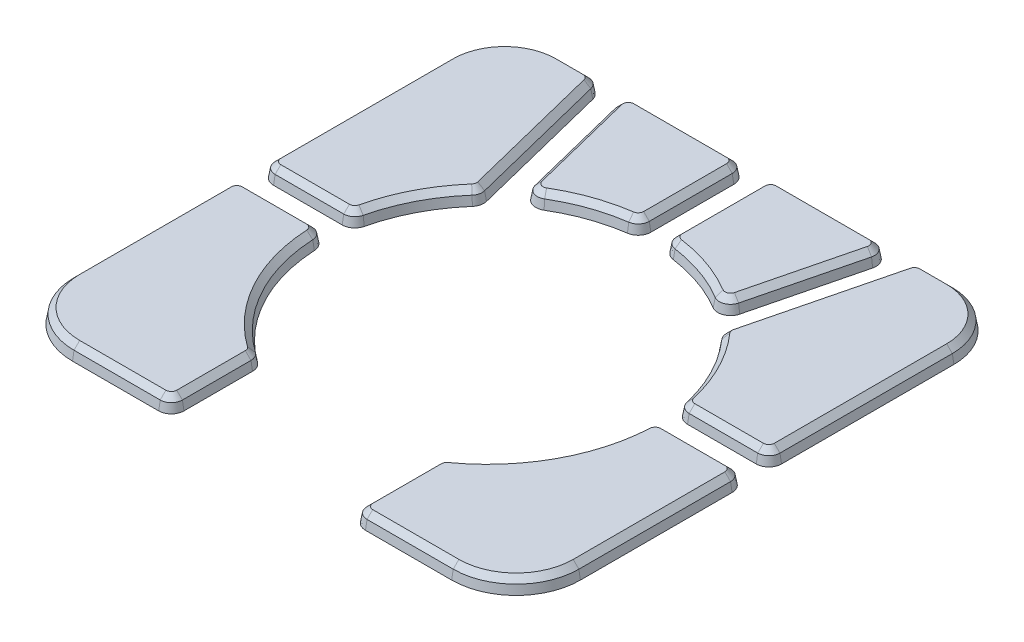
from build123d import *
from OCP.BRepFilletAPI import BRepFilletAPI_MakeChamfer

# Parameters (mm, degrees)
BOSS_EXTRUDE1_DEPTH           = 2.5
BOSS_EXTRUDE1_DRAFT           = 10
BOSS_EXTRUDE1_PROFILE_2_DEPTH = 2.5
BOSS_EXTRUDE1_PROFILE_2_DRAFT = 10
BOSS_EXTRUDE1_PROFILE_3_DEPTH = 2.5
BOSS_EXTRUDE1_PROFILE_3_DRAFT = 10
BOSS_EXTRUDE1_PROFILE_4_DEPTH = 2.5
BOSS_EXTRUDE1_PROFILE_4_DRAFT = 10
BOSS_EXTRUDE1_PROFILE_5_DEPTH = 2.5
BOSS_EXTRUDE1_PROFILE_5_DRAFT = 10
BOSS_EXTRUDE1_PROFILE_6_DEPTH = 2.5
BOSS_EXTRUDE1_PROFILE_6_DRAFT = 10
CHAMFER1_SIZE                 = 1
CHAMFER1_SIZE2                = 0.811159575
CHAMFER2_SIZE                 = 1
CHAMFER2_SIZE2                = 0.811159575
CHAMFER3_SIZE                 = 1
CHAMFER3_SIZE2                = 0.811159575
CHAMFER4_SIZE                 = 1
CHAMFER4_SIZE2                = 0.811159575
CHAMFER5_SIZE                 = 1
CHAMFER5_SIZE2                = 0.811159575
CHAMFER6_SIZE                 = 1
CHAMFER6_SIZE2                = 0.811159575
SKETCH4_R                     = 2.2
CUT_EXTRUDE2_DEPTH            = 2


with BuildPart() as part:
    # Sketch2 → Boss-Extrude1 (with draft: the straight prism first)
    with BuildSketch(Plane(origin=(0, 0, 0), x_dir=(1, 0, 0), z_dir=(0, 1, 0))):
        with BuildLine():
            Line((-4.3, 47.2), (-20.460175103, 47.2))
            ThreePointArc((-20.460175103, 47.2), (-22.193798761, 46.354455246), (-22.594825701, 44.46777183))
            Line((-22.594825701, 44.46777183), (-17.977666103, 25.949356145))
            ThreePointArc((-17.977666103, 25.949356145), (-16.686858715, 24.449853862), (-14.713533712, 24.593656647))
            ThreePointArc((-14.713533712, 24.593656647), (-9.543094512, 27.023422594), (-3.993443984, 28.379366214))
            ThreePointArc((-3.993443984, 28.379366214), (-2.639514644, 29.114716318), (-2.1, 30.557903202))
            Line((-2.1, 30.557903202), (-2.1, 45))
            ThreePointArc((-2.1, 45), (-2.744365081, 46.555634919), (-4.3, 47.2))
        make_face()
    extrude(amount=BOSS_EXTRUDE1_DEPTH)
    # Boss-Extrude1: the draft: its side faces are tilted about the plane it starts from
    boss_extrude1_sides = [part.faces().sort_by_distance(p)[0] for p in [
        (-2.744365081, 1.25, -46.555634919),
        (-12.380087552, 1.25, -47.2),
        (-22.193798761, 1.25, -46.354455246),
        (-20.286245902, 1.25, -35.208563987),
        (-16.686858715, 1.25, -24.449853862),
        (-9.543094512, 1.25, -27.023422594),
        (-2.639514644, 1.25, -29.114716318),
        (-2.1, 1.25, -37.778951601),
    ]]
    draft(boss_extrude1_sides, Plane(origin=(0, 0, 0), x_dir=(1, 0, 0), z_dir=(0, 1, 0)), BOSS_EXTRUDE1_DRAFT)

    # Chamfer3: one chamfer whose edges measure the first distance from different faces: ONE call of the kernel's chamfer builder (chamfer() names one face for all edges)
    chamfer3_edges_1 = [part.edges().sort_by_distance(p)[0] for p in [
        (-21.846429869, 2.5, -46.083060923),
    ]]
    chamfer3_side_1 = [part.faces().sort_by_distance(p)[0] for p in [
        (-22.020114315, 1.25, -46.218758084),
    ]]
    chamfer3_edges_2 = [part.edges().sort_by_distance(p)[0] for p in [
        (-19.858522612, 2.5, -35.315207381),
    ]]
    chamfer3_side_2 = [part.faces().sort_by_distance(p)[0] for p in [
        (-20.072384257, 1.25, -35.261885684),
    ]]
    chamfer3_edges_3 = [part.edges().sort_by_distance(p)[0] for p in [
        (-16.517776527, 2.5, -24.85695488),
    ]]
    chamfer3_side_3 = [part.faces().sort_by_distance(p)[0] for p in [
        (-16.602317621, 1.25, -24.653404371),
    ]]
    chamfer3_edges_4 = [part.edges().sort_by_distance(p)[0] for p in [
        (-9.689881504, 2.5, -27.439083038),
    ]]
    chamfer3_side_4 = [part.faces().sort_by_distance(p)[0] for p in [
        (-9.616488008, 1.25, -27.231252816),
    ]]
    chamfer3_edges_5 = [part.edges().sort_by_distance(p)[0] for p in [
        (-2.9722287, 2.5, -29.403889939),
    ]]
    chamfer3_side_5 = [part.faces().sort_by_distance(p)[0] for p in [
        (-2.805871672, 1.25, -29.259303128),
    ]]
    chamfer3_edges_6 = [part.edges().sort_by_distance(p)[0] for p in [
        (-2.540817452, 2.5, -37.778951601),
    ]]
    chamfer3_side_6 = [part.faces().sort_by_distance(p)[0] for p in [
        (-2.320408726, 1.25, -37.778951601),
    ]]
    chamfer3_edges_7 = [part.edges().sort_by_distance(p)[0] for p in [
        (-3.056070091, 2.5, -46.243929909),
    ]]
    chamfer3_side_7 = [part.faces().sort_by_distance(p)[0] for p in [
        (-2.900217586, 1.25, -46.399782414),
    ]]
    chamfer3_edges_8 = [part.edges().sort_by_distance(p)[0] for p in [
        (-12.380087552, 2.5, -46.759182548),
    ]]
    chamfer3_side_8 = [part.faces().sort_by_distance(p)[0] for p in [
        (-12.380087552, 1.25, -46.979591274),
    ]]
    chamfer3 = BRepFilletAPI_MakeChamfer(part.part.solid().wrapped)
    for e in chamfer3_edges_1:
        chamfer3.Add(CHAMFER3_SIZE, CHAMFER3_SIZE2, e.wrapped, chamfer3_side_1[0].wrapped)  # the first distance lies on this face
    for e in chamfer3_edges_2:
        chamfer3.Add(CHAMFER3_SIZE, CHAMFER3_SIZE2, e.wrapped, chamfer3_side_2[0].wrapped)  # the first distance lies on this face
    for e in chamfer3_edges_3:
        chamfer3.Add(CHAMFER3_SIZE, CHAMFER3_SIZE2, e.wrapped, chamfer3_side_3[0].wrapped)  # the first distance lies on this face
    for e in chamfer3_edges_4:
        chamfer3.Add(CHAMFER3_SIZE, CHAMFER3_SIZE2, e.wrapped, chamfer3_side_4[0].wrapped)  # the first distance lies on this face
    for e in chamfer3_edges_5:
        chamfer3.Add(CHAMFER3_SIZE, CHAMFER3_SIZE2, e.wrapped, chamfer3_side_5[0].wrapped)  # the first distance lies on this face
    for e in chamfer3_edges_6:
        chamfer3.Add(CHAMFER3_SIZE, CHAMFER3_SIZE2, e.wrapped, chamfer3_side_6[0].wrapped)  # the first distance lies on this face
    for e in chamfer3_edges_7:
        chamfer3.Add(CHAMFER3_SIZE, CHAMFER3_SIZE2, e.wrapped, chamfer3_side_7[0].wrapped)  # the first distance lies on this face
    for e in chamfer3_edges_8:
        chamfer3.Add(CHAMFER3_SIZE, CHAMFER3_SIZE2, e.wrapped, chamfer3_side_8[0].wrapped)  # the first distance lies on this face
    add(Compound.cast(chamfer3.Shape()), mode=Mode.REPLACE)


with BuildPart() as body_2:
    # Sketch2 → Boss-Extrude1 profile 2 (with draft: the straight prism first)
    with BuildSketch(Plane(origin=(0, 0, 0), x_dir=(1, 0, 0), z_dir=(0, 1, 0))):
        with BuildLine():
            Line((-42, 4.8), (-30.054541223, 4.8))
            ThreePointArc((-30.054541223, 4.8), (-28.686677613, 5.276936117), (-27.911889966, 6.500955324))
            ThreePointArc((-27.911889966, 6.500955324), (-25.488118202, 13.103123753), (-21.52937617, 18.916183106))
            ThreePointArc((-21.52937617, 18.916183106), (-21.044227674, 19.849041411), (-21.047424296, 20.9005087))
            Line((-21.047424296, 20.9005087), (-27.188801718, 45.53222817))
            ThreePointArc((-27.188801718, 45.53222817), (-27.96899707, 46.733623658), (-29.323452316, 47.2))
            Line((-29.323452316, 47.2), (-34, 47.2))
            ThreePointArc((-34, 47.2), (-41.212489168, 44.212489168), (-44.2, 37))
            Line((-44.2, 37), (-44.2, 7))
            ThreePointArc((-44.2, 7), (-43.555634919, 5.444365081), (-42, 4.8))
        make_face()
    extrude(amount=BOSS_EXTRUDE1_PROFILE_2_DEPTH)
    # Boss-Extrude1 profile 2: the draft: its side faces are tilted about the plane it starts from
    boss_extrude1_profile_2_sides = [body_2.faces().sort_by_distance(p)[0] for p in [
        (-36.027270612, 1.25, -4.8),
        (-28.686677613, 1.25, -5.276936117),
        (-25.488118202, 1.25, -13.103123753),
        (-21.044227674, 1.25, -19.849041411),
        (-24.118113007, 1.25, -33.216368435),
        (-27.96899707, 1.25, -46.733623658),
        (-31.661726158, 1.25, -47.2),
        (-41.212489168, 1.25, -44.212489168),
        (-44.2, 1.25, -22),
        (-43.555634919, 1.25, -5.444365081),
    ]]
    draft(boss_extrude1_profile_2_sides, Plane(origin=(0, 0, 0), x_dir=(1, 0, 0), z_dir=(0, 1, 0)), BOSS_EXTRUDE1_PROFILE_2_DRAFT)

    # Chamfer2: one chamfer whose edges measure the first distance from different faces: ONE call of the kernel's chamfer builder (chamfer() names one face for all edges)
    chamfer2_edges_1 = [body_2.edges().sort_by_distance(p)[0] for p in [
        (-28.240391393, 2.5, -46.386254766),
    ]]
    chamfer2_side_1 = [body_2.faces().sort_by_distance(p)[0] for p in [
        (-28.104694231, 1.25, -46.559939212),
    ]]
    chamfer2_edges_2 = [body_2.edges().sort_by_distance(p)[0] for p in [
        (-31.661726158, 2.5, -46.759182548),
    ]]
    chamfer2_side_2 = [body_2.faces().sort_by_distance(p)[0] for p in [
        (-31.661726158, 1.25, -46.979591274),
    ]]
    chamfer2_edges_3 = [body_2.edges().sort_by_distance(p)[0] for p in [
        (-40.900784159, 2.5, -43.900784159),
    ]]
    chamfer2_side_3 = [body_2.faces().sort_by_distance(p)[0] for p in [
        (-41.056636663, 1.25, -44.056636663),
    ]]
    chamfer2_edges_4 = [body_2.edges().sort_by_distance(p)[0] for p in [
        (-43.759182548, 2.5, -22),
    ]]
    chamfer2_side_4 = [body_2.faces().sort_by_distance(p)[0] for p in [
        (-43.979591274, 1.25, -22),
    ]]
    chamfer2_edges_5 = [body_2.edges().sort_by_distance(p)[0] for p in [
        (-43.243929909, 2.5, -5.756070091),
    ]]
    chamfer2_side_5 = [body_2.faces().sort_by_distance(p)[0] for p in [
        (-43.399782414, 1.25, -5.600217586),
    ]]
    chamfer2_edges_6 = [body_2.edges().sort_by_distance(p)[0] for p in [
        (-36.027270612, 2.5, -5.240817452),
    ]]
    chamfer2_side_6 = [body_2.faces().sort_by_distance(p)[0] for p in [
        (-36.027270612, 1.25, -5.020408726),
    ]]
    chamfer2_edges_7 = [body_2.edges().sort_by_distance(p)[0] for p in [
        (-28.960758591, 2.5, -5.622189131),
    ]]
    chamfer2_side_7 = [body_2.faces().sort_by_distance(p)[0] for p in [
        (-28.823718102, 1.25, -5.449562624),
    ]]
    chamfer2_edges_8 = [body_2.edges().sort_by_distance(p)[0] for p in [
        (-25.880163381, 2.5, -13.30466929),
    ]]
    chamfer2_side_8 = [body_2.faces().sort_by_distance(p)[0] for p in [
        (-25.684140792, 1.25, -13.203896521),
    ]]
    chamfer2_edges_9 = [body_2.edges().sort_by_distance(p)[0] for p in [
        (-21.472591475, 2.5, -19.953082168),
    ]]
    chamfer2_side_9 = [body_2.faces().sort_by_distance(p)[0] for p in [
        (-21.258409575, 1.25, -19.901061789),
    ]]
    chamfer2_edges_10 = [body_2.edges().sort_by_distance(p)[0] for p in [
        (-24.545836297, 2.5, -33.109725042),
    ]]
    chamfer2_side_10 = [body_2.faces().sort_by_distance(p)[0] for p in [
        (-24.331974652, 1.25, -33.163046739),
    ]]
    chamfer2 = BRepFilletAPI_MakeChamfer(body_2.part.solid().wrapped)
    for e in chamfer2_edges_1:
        chamfer2.Add(CHAMFER2_SIZE, CHAMFER2_SIZE2, e.wrapped, chamfer2_side_1[0].wrapped)  # the first distance lies on this face
    for e in chamfer2_edges_2:
        chamfer2.Add(CHAMFER2_SIZE, CHAMFER2_SIZE2, e.wrapped, chamfer2_side_2[0].wrapped)  # the first distance lies on this face
    for e in chamfer2_edges_3:
        chamfer2.Add(CHAMFER2_SIZE, CHAMFER2_SIZE2, e.wrapped, chamfer2_side_3[0].wrapped)  # the first distance lies on this face
    for e in chamfer2_edges_4:
        chamfer2.Add(CHAMFER2_SIZE, CHAMFER2_SIZE2, e.wrapped, chamfer2_side_4[0].wrapped)  # the first distance lies on this face
    for e in chamfer2_edges_5:
        chamfer2.Add(CHAMFER2_SIZE, CHAMFER2_SIZE2, e.wrapped, chamfer2_side_5[0].wrapped)  # the first distance lies on this face
    for e in chamfer2_edges_6:
        chamfer2.Add(CHAMFER2_SIZE, CHAMFER2_SIZE2, e.wrapped, chamfer2_side_6[0].wrapped)  # the first distance lies on this face
    for e in chamfer2_edges_7:
        chamfer2.Add(CHAMFER2_SIZE, CHAMFER2_SIZE2, e.wrapped, chamfer2_side_7[0].wrapped)  # the first distance lies on this face
    for e in chamfer2_edges_8:
        chamfer2.Add(CHAMFER2_SIZE, CHAMFER2_SIZE2, e.wrapped, chamfer2_side_8[0].wrapped)  # the first distance lies on this face
    for e in chamfer2_edges_9:
        chamfer2.Add(CHAMFER2_SIZE, CHAMFER2_SIZE2, e.wrapped, chamfer2_side_9[0].wrapped)  # the first distance lies on this face
    for e in chamfer2_edges_10:
        chamfer2.Add(CHAMFER2_SIZE, CHAMFER2_SIZE2, e.wrapped, chamfer2_side_10[0].wrapped)  # the first distance lies on this face
    add(Compound.cast(chamfer2.Shape()), mode=Mode.REPLACE)


with BuildPart() as body_3:
    # Sketch2 → Boss-Extrude1 profile 3 (with draft: the straight prism first)
    with BuildSketch(Plane(origin=(0, 0, 0), x_dir=(1, 0, 0), z_dir=(0, 1, 0))):
        with BuildLine():
            Line((20.460175103, 47.2), (4.3, 47.2))
            ThreePointArc((4.3, 47.2), (2.744365081, 46.555634919), (2.1, 45))
            Line((2.1, 45), (2.1, 30.557903202))
            ThreePointArc((2.1, 30.557903202), (2.639514644, 29.114716318), (3.993443984, 28.379366214))
            ThreePointArc((3.993443984, 28.379366214), (9.543094512, 27.023422594), (14.713533712, 24.593656647))
            ThreePointArc((14.713533712, 24.593656647), (16.686858715, 24.449853862), (17.977666103, 25.949356145))
            Line((17.977666103, 25.949356145), (22.594825701, 44.46777183))
            ThreePointArc((22.594825701, 44.46777183), (22.193798761, 46.354455246), (20.460175103, 47.2))
        make_face()
    extrude(amount=BOSS_EXTRUDE1_PROFILE_3_DEPTH)
    # Boss-Extrude1 profile 3: the draft: its side faces are tilted about the plane it starts from
    boss_extrude1_profile_3_sides = [body_3.faces().sort_by_distance(p)[0] for p in [
        (22.193798761, 1.25, -46.354455246),
        (12.380087552, 1.25, -47.2),
        (2.744365081, 1.25, -46.555634919),
        (2.1, 1.25, -37.778951601),
        (2.639514644, 1.25, -29.114716318),
        (9.543094512, 1.25, -27.023422594),
        (16.686858715, 1.25, -24.449853862),
        (20.286245902, 1.25, -35.208563987),
    ]]
    draft(boss_extrude1_profile_3_sides, Plane(origin=(0, 0, 0), x_dir=(1, 0, 0), z_dir=(0, 1, 0)), BOSS_EXTRUDE1_PROFILE_3_DRAFT)

    # Chamfer4: one chamfer whose edges measure the first distance from different faces: ONE call of the kernel's chamfer builder (chamfer() names one face for all edges)
    chamfer4_edges_1 = [body_3.edges().sort_by_distance(p)[0] for p in [
        (21.846429869, 2.5, -46.083060923),
    ]]
    chamfer4_side_1 = [body_3.faces().sort_by_distance(p)[0] for p in [
        (22.020114315, 1.25, -46.218758084),
    ]]
    chamfer4_edges_2 = [body_3.edges().sort_by_distance(p)[0] for p in [
        (12.380087552, 2.5, -46.759182548),
    ]]
    chamfer4_side_2 = [body_3.faces().sort_by_distance(p)[0] for p in [
        (12.380087552, 1.25, -46.979591274),
    ]]
    chamfer4_edges_3 = [body_3.edges().sort_by_distance(p)[0] for p in [
        (3.056070091, 2.5, -46.243929909),
    ]]
    chamfer4_side_3 = [body_3.faces().sort_by_distance(p)[0] for p in [
        (2.900217586, 1.25, -46.399782414),
    ]]
    chamfer4_edges_4 = [body_3.edges().sort_by_distance(p)[0] for p in [
        (2.540817452, 2.5, -37.778951601),
    ]]
    chamfer4_side_4 = [body_3.faces().sort_by_distance(p)[0] for p in [
        (2.320408726, 1.25, -37.778951601),
    ]]
    chamfer4_edges_5 = [body_3.edges().sort_by_distance(p)[0] for p in [
        (2.9722287, 2.5, -29.403889939),
    ]]
    chamfer4_side_5 = [body_3.faces().sort_by_distance(p)[0] for p in [
        (2.805871672, 1.25, -29.259303128),
    ]]
    chamfer4_edges_6 = [body_3.edges().sort_by_distance(p)[0] for p in [
        (9.689881504, 2.5, -27.439083038),
    ]]
    chamfer4_side_6 = [body_3.faces().sort_by_distance(p)[0] for p in [
        (9.616488008, 1.25, -27.231252816),
    ]]
    chamfer4_edges_7 = [body_3.edges().sort_by_distance(p)[0] for p in [
        (16.517776527, 2.5, -24.85695488),
    ]]
    chamfer4_side_7 = [body_3.faces().sort_by_distance(p)[0] for p in [
        (16.602317621, 1.25, -24.653404371),
    ]]
    chamfer4_edges_8 = [body_3.edges().sort_by_distance(p)[0] for p in [
        (19.858522612, 2.5, -35.315207381),
    ]]
    chamfer4_side_8 = [body_3.faces().sort_by_distance(p)[0] for p in [
        (20.072384257, 1.25, -35.261885684),
    ]]
    chamfer4 = BRepFilletAPI_MakeChamfer(body_3.part.solid().wrapped)
    for e in chamfer4_edges_1:
        chamfer4.Add(CHAMFER4_SIZE, CHAMFER4_SIZE2, e.wrapped, chamfer4_side_1[0].wrapped)  # the first distance lies on this face
    for e in chamfer4_edges_2:
        chamfer4.Add(CHAMFER4_SIZE, CHAMFER4_SIZE2, e.wrapped, chamfer4_side_2[0].wrapped)  # the first distance lies on this face
    for e in chamfer4_edges_3:
        chamfer4.Add(CHAMFER4_SIZE, CHAMFER4_SIZE2, e.wrapped, chamfer4_side_3[0].wrapped)  # the first distance lies on this face
    for e in chamfer4_edges_4:
        chamfer4.Add(CHAMFER4_SIZE, CHAMFER4_SIZE2, e.wrapped, chamfer4_side_4[0].wrapped)  # the first distance lies on this face
    for e in chamfer4_edges_5:
        chamfer4.Add(CHAMFER4_SIZE, CHAMFER4_SIZE2, e.wrapped, chamfer4_side_5[0].wrapped)  # the first distance lies on this face
    for e in chamfer4_edges_6:
        chamfer4.Add(CHAMFER4_SIZE, CHAMFER4_SIZE2, e.wrapped, chamfer4_side_6[0].wrapped)  # the first distance lies on this face
    for e in chamfer4_edges_7:
        chamfer4.Add(CHAMFER4_SIZE, CHAMFER4_SIZE2, e.wrapped, chamfer4_side_7[0].wrapped)  # the first distance lies on this face
    for e in chamfer4_edges_8:
        chamfer4.Add(CHAMFER4_SIZE, CHAMFER4_SIZE2, e.wrapped, chamfer4_side_8[0].wrapped)  # the first distance lies on this face
    add(Compound.cast(chamfer4.Shape()), mode=Mode.REPLACE)


with BuildPart() as body_4:
    # Sketch2 → Boss-Extrude1 profile 4 (with draft: the straight prism first)
    with BuildSketch(Plane(origin=(0, 0, 0), x_dir=(1, 0, 0), z_dir=(0, 1, 0))):
        with BuildLine():
            Line((27.188801718, 45.53222817), (21.047424296, 20.9005087))
            ThreePointArc((21.047424296, 20.9005087), (21.044227674, 19.849041411), (21.52937617, 18.916183106))
            ThreePointArc((21.52937617, 18.916183106), (25.488118202, 13.103123753), (27.911889966, 6.500955324))
            ThreePointArc((27.911889966, 6.500955324), (28.686677613, 5.276936117), (30.054541223, 4.8))
            Line((30.054541223, 4.8), (42, 4.8))
            ThreePointArc((42, 4.8), (43.555634919, 5.444365081), (44.2, 7))
            Line((44.2, 7), (44.2, 37))
            ThreePointArc((44.2, 37), (41.212489168, 44.212489168), (34, 47.2))
            Line((34, 47.2), (29.323452316, 47.2))
            ThreePointArc((29.323452316, 47.2), (27.96899707, 46.733623658), (27.188801718, 45.53222817))
        make_face()
    extrude(amount=BOSS_EXTRUDE1_PROFILE_4_DEPTH)
    # Boss-Extrude1 profile 4: the draft: its side faces are tilted about the plane it starts from
    boss_extrude1_profile_4_sides = [body_4.faces().sort_by_distance(p)[0] for p in [
        (24.118113007, 1.25, -33.216368435),
        (21.044227674, 1.25, -19.849041411),
        (25.488118202, 1.25, -13.103123753),
        (28.686677613, 1.25, -5.276936117),
        (36.027270612, 1.25, -4.8),
        (43.555634919, 1.25, -5.444365081),
        (44.2, 1.25, -22),
        (41.212489168, 1.25, -44.212489168),
        (31.661726158, 1.25, -47.2),
        (27.96899707, 1.25, -46.733623658),
    ]]
    draft(boss_extrude1_profile_4_sides, Plane(origin=(0, 0, 0), x_dir=(1, 0, 0), z_dir=(0, 1, 0)), BOSS_EXTRUDE1_PROFILE_4_DRAFT)

    # Chamfer5: one chamfer whose edges measure the first distance from different faces: ONE call of the kernel's chamfer builder (chamfer() names one face for all edges)
    chamfer5_edges_1 = [body_4.edges().sort_by_distance(p)[0] for p in [
        (43.243929909, 2.5, -5.756070091),
    ]]
    chamfer5_side_1 = [body_4.faces().sort_by_distance(p)[0] for p in [
        (43.399782414, 1.25, -5.600217586),
    ]]
    chamfer5_edges_2 = [body_4.edges().sort_by_distance(p)[0] for p in [
        (43.759182548, 2.5, -22),
    ]]
    chamfer5_side_2 = [body_4.faces().sort_by_distance(p)[0] for p in [
        (43.979591274, 1.25, -22),
    ]]
    chamfer5_edges_3 = [body_4.edges().sort_by_distance(p)[0] for p in [
        (40.900784159, 2.5, -43.900784159),
    ]]
    chamfer5_side_3 = [body_4.faces().sort_by_distance(p)[0] for p in [
        (41.056636663, 1.25, -44.056636663),
    ]]
    chamfer5_edges_4 = [body_4.edges().sort_by_distance(p)[0] for p in [
        (31.661726158, 2.5, -46.759182548),
    ]]
    chamfer5_side_4 = [body_4.faces().sort_by_distance(p)[0] for p in [
        (31.661726158, 1.25, -46.979591274),
    ]]
    chamfer5_edges_5 = [body_4.edges().sort_by_distance(p)[0] for p in [
        (28.240391393, 2.5, -46.386254766),
    ]]
    chamfer5_side_5 = [body_4.faces().sort_by_distance(p)[0] for p in [
        (28.104694231, 1.25, -46.559939212),
    ]]
    chamfer5_edges_6 = [body_4.edges().sort_by_distance(p)[0] for p in [
        (24.545836297, 2.5, -33.109725042),
    ]]
    chamfer5_side_6 = [body_4.faces().sort_by_distance(p)[0] for p in [
        (24.331974652, 1.25, -33.163046739),
    ]]
    chamfer5_edges_7 = [body_4.edges().sort_by_distance(p)[0] for p in [
        (21.472591475, 2.5, -19.953082168),
    ]]
    chamfer5_side_7 = [body_4.faces().sort_by_distance(p)[0] for p in [
        (21.258409575, 1.25, -19.901061789),
    ]]
    chamfer5_edges_8 = [body_4.edges().sort_by_distance(p)[0] for p in [
        (25.880163381, 2.5, -13.30466929),
    ]]
    chamfer5_side_8 = [body_4.faces().sort_by_distance(p)[0] for p in [
        (25.684140792, 1.25, -13.203896521),
    ]]
    chamfer5_edges_9 = [body_4.edges().sort_by_distance(p)[0] for p in [
        (28.960758591, 2.5, -5.622189131),
    ]]
    chamfer5_side_9 = [body_4.faces().sort_by_distance(p)[0] for p in [
        (28.823718102, 1.25, -5.449562624),
    ]]
    chamfer5_edges_10 = [body_4.edges().sort_by_distance(p)[0] for p in [
        (36.027270612, 2.5, -5.240817452),
    ]]
    chamfer5_side_10 = [body_4.faces().sort_by_distance(p)[0] for p in [
        (36.027270612, 1.25, -5.020408726),
    ]]
    chamfer5 = BRepFilletAPI_MakeChamfer(body_4.part.solid().wrapped)
    for e in chamfer5_edges_1:
        chamfer5.Add(CHAMFER5_SIZE, CHAMFER5_SIZE2, e.wrapped, chamfer5_side_1[0].wrapped)  # the first distance lies on this face
    for e in chamfer5_edges_2:
        chamfer5.Add(CHAMFER5_SIZE, CHAMFER5_SIZE2, e.wrapped, chamfer5_side_2[0].wrapped)  # the first distance lies on this face
    for e in chamfer5_edges_3:
        chamfer5.Add(CHAMFER5_SIZE, CHAMFER5_SIZE2, e.wrapped, chamfer5_side_3[0].wrapped)  # the first distance lies on this face
    for e in chamfer5_edges_4:
        chamfer5.Add(CHAMFER5_SIZE, CHAMFER5_SIZE2, e.wrapped, chamfer5_side_4[0].wrapped)  # the first distance lies on this face
    for e in chamfer5_edges_5:
        chamfer5.Add(CHAMFER5_SIZE, CHAMFER5_SIZE2, e.wrapped, chamfer5_side_5[0].wrapped)  # the first distance lies on this face
    for e in chamfer5_edges_6:
        chamfer5.Add(CHAMFER5_SIZE, CHAMFER5_SIZE2, e.wrapped, chamfer5_side_6[0].wrapped)  # the first distance lies on this face
    for e in chamfer5_edges_7:
        chamfer5.Add(CHAMFER5_SIZE, CHAMFER5_SIZE2, e.wrapped, chamfer5_side_7[0].wrapped)  # the first distance lies on this face
    for e in chamfer5_edges_8:
        chamfer5.Add(CHAMFER5_SIZE, CHAMFER5_SIZE2, e.wrapped, chamfer5_side_8[0].wrapped)  # the first distance lies on this face
    for e in chamfer5_edges_9:
        chamfer5.Add(CHAMFER5_SIZE, CHAMFER5_SIZE2, e.wrapped, chamfer5_side_9[0].wrapped)  # the first distance lies on this face
    for e in chamfer5_edges_10:
        chamfer5.Add(CHAMFER5_SIZE, CHAMFER5_SIZE2, e.wrapped, chamfer5_side_10[0].wrapped)  # the first distance lies on this face
    add(Compound.cast(chamfer5.Shape()), mode=Mode.REPLACE)


with BuildPart() as body_5:
    # Sketch2 → Boss-Extrude1 profile 5 (with draft: the straight prism first)
    with BuildSketch(Plane(origin=(0, 0, 0), x_dir=(1, 0, 0), z_dir=(0, 1, 0))):
        with BuildLine():
            Line((15.8, -25.065423358), (15.8, -37))
            ThreePointArc((15.8, -37), (16.444365081, -38.555634919), (18, -39.2))
            Line((18, -39.2), (33, -39.2))
            ThreePointArc((33, -39.2), (40.919595949, -35.919595949), (44.2, -28))
            Line((44.2, -28), (44.2, -1.6))
            ThreePointArc((44.2, -1.6), (43.555634919, -0.044365081), (42, 0.6))
            Line((42, 0.6), (30.817453628, 0.6))
            ThreePointArc((30.817453628, 0.6), (29.302684369, -0.004545804), (28.620412746, -1.485932645))
            ThreePointArc((28.620412746, -1.485932645), (25.151400219, -13.73838013), (16.71674226, -23.278456774))
            ThreePointArc((16.71674226, -23.278456774), (16.042556894, -24.061223933), (15.8, -25.065423358))
        make_face()
    extrude(amount=BOSS_EXTRUDE1_PROFILE_5_DEPTH)
    # Boss-Extrude1 profile 5: the draft: its side faces are tilted about the plane it starts from
    boss_extrude1_profile_5_sides = [body_5.faces().sort_by_distance(p)[0] for p in [
        (16.042556894, 1.25, 24.061223933),
        (15.8, 1.25, 31.032711679),
        (16.444365081, 1.25, 38.555634919),
        (25.5, 1.25, 39.2),
        (40.919595949, 1.25, 35.919595949),
        (44.2, 1.25, 14.8),
        (43.555634919, 1.25, 0.044365081),
        (36.408726814, 1.25, -0.6),
        (29.302684369, 1.25, 0.004545804),
        (25.151400219, 1.25, 13.73838013),
    ]]
    draft(boss_extrude1_profile_5_sides, Plane(origin=(0, 0, 0), x_dir=(1, 0, 0), z_dir=(0, 1, 0)), BOSS_EXTRUDE1_PROFILE_5_DRAFT)

    # Chamfer6: one chamfer whose edges measure the first distance from different faces: ONE call of the kernel's chamfer builder (chamfer() names one face for all edges)
    chamfer6_edges_1 = [body_5.edges().sort_by_distance(p)[0] for p in [
        (43.243929909, 2.5, 0.356070091),
    ]]
    chamfer6_side_1 = [body_5.faces().sort_by_distance(p)[0] for p in [
        (43.399782414, 1.25, 0.200217586),
    ]]
    chamfer6_edges_2 = [body_5.edges().sort_by_distance(p)[0] for p in [
        (36.408726814, 2.5, -0.159182548),
    ]]
    chamfer6_side_2 = [body_5.faces().sort_by_distance(p)[0] for p in [
        (36.408726814, 1.25, -0.379591274),
    ]]
    chamfer6_edges_3 = [body_5.edges().sort_by_distance(p)[0] for p in [
        (29.606201062, 2.5, 0.324229465),
    ]]
    chamfer6_side_3 = [body_5.faces().sort_by_distance(p)[0] for p in [
        (29.454442715, 1.25, 0.164387635),
    ]]
    chamfer6_edges_4 = [body_5.edges().sort_by_distance(p)[0] for p in [
        (25.538266174, 2.5, 13.949696856),
    ]]
    chamfer6_side_4 = [body_5.faces().sort_by_distance(p)[0] for p in [
        (25.344833197, 1.25, 13.844038493),
    ]]
    chamfer6_edges_5 = [body_5.edges().sort_by_distance(p)[0] for p in [
        (16.43477284, 2.5, 24.262436947),
    ]]
    chamfer6_side_5 = [body_5.faces().sort_by_distance(p)[0] for p in [
        (16.238664867, 1.25, 24.16183044),
    ]]
    chamfer6_edges_6 = [body_5.edges().sort_by_distance(p)[0] for p in [
        (16.240817452, 2.5, 31.032711679),
    ]]
    chamfer6_side_6 = [body_5.faces().sort_by_distance(p)[0] for p in [
        (16.020408726, 1.25, 31.032711679),
    ]]
    chamfer6_edges_7 = [body_5.edges().sort_by_distance(p)[0] for p in [
        (16.756070091, 2.5, 38.243929909),
    ]]
    chamfer6_side_7 = [body_5.faces().sort_by_distance(p)[0] for p in [
        (16.600217586, 1.25, 38.399782414),
    ]]
    chamfer6_edges_8 = [body_5.edges().sort_by_distance(p)[0] for p in [
        (25.5, 2.5, 38.759182548),
    ]]
    chamfer6_side_8 = [body_5.faces().sort_by_distance(p)[0] for p in [
        (25.5, 1.25, 38.979591274),
    ]]
    chamfer6_edges_9 = [body_5.edges().sort_by_distance(p)[0] for p in [
        (40.60789094, 2.5, 35.60789094),
    ]]
    chamfer6_side_9 = [body_5.faces().sort_by_distance(p)[0] for p in [
        (40.763743445, 1.25, 35.763743445),
    ]]
    chamfer6_edges_10 = [body_5.edges().sort_by_distance(p)[0] for p in [
        (43.759182548, 2.5, 14.8),
    ]]
    chamfer6_side_10 = [body_5.faces().sort_by_distance(p)[0] for p in [
        (43.979591274, 1.25, 14.8),
    ]]
    chamfer6 = BRepFilletAPI_MakeChamfer(body_5.part.solid().wrapped)
    for e in chamfer6_edges_1:
        chamfer6.Add(CHAMFER6_SIZE, CHAMFER6_SIZE2, e.wrapped, chamfer6_side_1[0].wrapped)  # the first distance lies on this face
    for e in chamfer6_edges_2:
        chamfer6.Add(CHAMFER6_SIZE, CHAMFER6_SIZE2, e.wrapped, chamfer6_side_2[0].wrapped)  # the first distance lies on this face
    for e in chamfer6_edges_3:
        chamfer6.Add(CHAMFER6_SIZE, CHAMFER6_SIZE2, e.wrapped, chamfer6_side_3[0].wrapped)  # the first distance lies on this face
    for e in chamfer6_edges_4:
        chamfer6.Add(CHAMFER6_SIZE, CHAMFER6_SIZE2, e.wrapped, chamfer6_side_4[0].wrapped)  # the first distance lies on this face
    for e in chamfer6_edges_5:
        chamfer6.Add(CHAMFER6_SIZE, CHAMFER6_SIZE2, e.wrapped, chamfer6_side_5[0].wrapped)  # the first distance lies on this face
    for e in chamfer6_edges_6:
        chamfer6.Add(CHAMFER6_SIZE, CHAMFER6_SIZE2, e.wrapped, chamfer6_side_6[0].wrapped)  # the first distance lies on this face
    for e in chamfer6_edges_7:
        chamfer6.Add(CHAMFER6_SIZE, CHAMFER6_SIZE2, e.wrapped, chamfer6_side_7[0].wrapped)  # the first distance lies on this face
    for e in chamfer6_edges_8:
        chamfer6.Add(CHAMFER6_SIZE, CHAMFER6_SIZE2, e.wrapped, chamfer6_side_8[0].wrapped)  # the first distance lies on this face
    for e in chamfer6_edges_9:
        chamfer6.Add(CHAMFER6_SIZE, CHAMFER6_SIZE2, e.wrapped, chamfer6_side_9[0].wrapped)  # the first distance lies on this face
    for e in chamfer6_edges_10:
        chamfer6.Add(CHAMFER6_SIZE, CHAMFER6_SIZE2, e.wrapped, chamfer6_side_10[0].wrapped)  # the first distance lies on this face
    add(Compound.cast(chamfer6.Shape()), mode=Mode.REPLACE)


with BuildPart() as body_6:
    # Sketch2 → Boss-Extrude1 profile 6 (with draft: the straight prism first)
    with BuildSketch(Plane(origin=(0, 0, 0), x_dir=(1, 0, 0), z_dir=(0, 1, 0))):
        with BuildLine():
            Line((-33, -39.2), (-18, -39.2))
            ThreePointArc((-18, -39.2), (-16.444365081, -38.555634919), (-15.8, -37))
            Line((-15.8, -37), (-15.8, -25.065423358))
            ThreePointArc((-15.8, -25.065423358), (-16.042556894, -24.061223933), (-16.71674226, -23.278456774))
            ThreePointArc((-16.71674226, -23.278456774), (-25.151400219, -13.73838013), (-28.620412746, -1.485932645))
            ThreePointArc((-28.620412746, -1.485932645), (-29.302684369, -0.004545804), (-30.817453628, 0.6))
            Line((-30.817453628, 0.6), (-42, 0.6))
            ThreePointArc((-42, 0.6), (-43.555634919, -0.044365081), (-44.2, -1.6))
            Line((-44.2, -1.6), (-44.2, -28))
            ThreePointArc((-44.2, -28), (-40.919595949, -35.919595949), (-33, -39.2))
        make_face()
    extrude(amount=BOSS_EXTRUDE1_PROFILE_6_DEPTH)
    # Boss-Extrude1 profile 6: the draft: its side faces are tilted about the plane it starts from
    boss_extrude1_profile_6_sides = [body_6.faces().sort_by_distance(p)[0] for p in [
        (-29.302684369, 1.25, 0.004545804),
        (-36.408726814, 1.25, -0.6),
        (-43.555634919, 1.25, 0.044365081),
        (-44.2, 1.25, 14.8),
        (-40.919595949, 1.25, 35.919595949),
        (-25.5, 1.25, 39.2),
        (-16.444365081, 1.25, 38.555634919),
        (-15.8, 1.25, 31.032711679),
        (-16.042556894, 1.25, 24.061223933),
        (-25.151400219, 1.25, 13.73838013),
    ]]
    draft(boss_extrude1_profile_6_sides, Plane(origin=(0, 0, 0), x_dir=(1, 0, 0), z_dir=(0, 1, 0)), BOSS_EXTRUDE1_PROFILE_6_DRAFT)

    # Chamfer1: one chamfer whose edges measure the first distance from different faces: ONE call of the kernel's chamfer builder (chamfer() names one face for all edges)
    chamfer1_edges_1 = [body_6.edges().sort_by_distance(p)[0] for p in [
        (-29.606201062, 2.5, 0.324229465),
    ]]
    chamfer1_side_1 = [body_6.faces().sort_by_distance(p)[0] for p in [
        (-29.454442715, 1.25, 0.164387635),
    ]]
    chamfer1_edges_2 = [body_6.edges().sort_by_distance(p)[0] for p in [
        (-36.408726814, 2.5, -0.159182548),
    ]]
    chamfer1_side_2 = [body_6.faces().sort_by_distance(p)[0] for p in [
        (-36.408726814, 1.25, -0.379591274),
    ]]
    chamfer1_edges_3 = [body_6.edges().sort_by_distance(p)[0] for p in [
        (-43.243929909, 2.5, 0.356070091),
    ]]
    chamfer1_side_3 = [body_6.faces().sort_by_distance(p)[0] for p in [
        (-43.399782414, 1.25, 0.200217586),
    ]]
    chamfer1_edges_4 = [body_6.edges().sort_by_distance(p)[0] for p in [
        (-43.759182548, 2.5, 14.8),
    ]]
    chamfer1_side_4 = [body_6.faces().sort_by_distance(p)[0] for p in [
        (-43.979591274, 1.25, 14.8),
    ]]
    chamfer1_edges_5 = [body_6.edges().sort_by_distance(p)[0] for p in [
        (-40.60789094, 2.5, 35.60789094),
    ]]
    chamfer1_side_5 = [body_6.faces().sort_by_distance(p)[0] for p in [
        (-40.763743445, 1.25, 35.763743445),
    ]]
    chamfer1_edges_6 = [body_6.edges().sort_by_distance(p)[0] for p in [
        (-25.5, 2.5, 38.759182548),
    ]]
    chamfer1_side_6 = [body_6.faces().sort_by_distance(p)[0] for p in [
        (-25.5, 1.25, 38.979591274),
    ]]
    chamfer1_edges_7 = [body_6.edges().sort_by_distance(p)[0] for p in [
        (-16.756070091, 2.5, 38.243929909),
    ]]
    chamfer1_side_7 = [body_6.faces().sort_by_distance(p)[0] for p in [
        (-16.600217586, 1.25, 38.399782414),
    ]]
    chamfer1_edges_8 = [body_6.edges().sort_by_distance(p)[0] for p in [
        (-16.240817452, 2.5, 31.032711679),
    ]]
    chamfer1_side_8 = [body_6.faces().sort_by_distance(p)[0] for p in [
        (-16.020408726, 1.25, 31.032711679),
    ]]
    chamfer1_edges_9 = [body_6.edges().sort_by_distance(p)[0] for p in [
        (-16.43477284, 2.5, 24.262436947),
    ]]
    chamfer1_side_9 = [body_6.faces().sort_by_distance(p)[0] for p in [
        (-16.238664867, 1.25, 24.16183044),
    ]]
    chamfer1_edges_10 = [body_6.edges().sort_by_distance(p)[0] for p in [
        (-25.538266174, 2.5, 13.949696856),
    ]]
    chamfer1_side_10 = [body_6.faces().sort_by_distance(p)[0] for p in [
        (-25.344833197, 1.25, 13.844038493),
    ]]
    chamfer1 = BRepFilletAPI_MakeChamfer(body_6.part.solid().wrapped)
    for e in chamfer1_edges_1:
        chamfer1.Add(CHAMFER1_SIZE, CHAMFER1_SIZE2, e.wrapped, chamfer1_side_1[0].wrapped)  # the first distance lies on this face
    for e in chamfer1_edges_2:
        chamfer1.Add(CHAMFER1_SIZE, CHAMFER1_SIZE2, e.wrapped, chamfer1_side_2[0].wrapped)  # the first distance lies on this face
    for e in chamfer1_edges_3:
        chamfer1.Add(CHAMFER1_SIZE, CHAMFER1_SIZE2, e.wrapped, chamfer1_side_3[0].wrapped)  # the first distance lies on this face
    for e in chamfer1_edges_4:
        chamfer1.Add(CHAMFER1_SIZE, CHAMFER1_SIZE2, e.wrapped, chamfer1_side_4[0].wrapped)  # the first distance lies on this face
    for e in chamfer1_edges_5:
        chamfer1.Add(CHAMFER1_SIZE, CHAMFER1_SIZE2, e.wrapped, chamfer1_side_5[0].wrapped)  # the first distance lies on this face
    for e in chamfer1_edges_6:
        chamfer1.Add(CHAMFER1_SIZE, CHAMFER1_SIZE2, e.wrapped, chamfer1_side_6[0].wrapped)  # the first distance lies on this face
    for e in chamfer1_edges_7:
        chamfer1.Add(CHAMFER1_SIZE, CHAMFER1_SIZE2, e.wrapped, chamfer1_side_7[0].wrapped)  # the first distance lies on this face
    for e in chamfer1_edges_8:
        chamfer1.Add(CHAMFER1_SIZE, CHAMFER1_SIZE2, e.wrapped, chamfer1_side_8[0].wrapped)  # the first distance lies on this face
    for e in chamfer1_edges_9:
        chamfer1.Add(CHAMFER1_SIZE, CHAMFER1_SIZE2, e.wrapped, chamfer1_side_9[0].wrapped)  # the first distance lies on this face
    for e in chamfer1_edges_10:
        chamfer1.Add(CHAMFER1_SIZE, CHAMFER1_SIZE2, e.wrapped, chamfer1_side_10[0].wrapped)  # the first distance lies on this face
    add(Compound.cast(chamfer1.Shape()), mode=Mode.REPLACE)


with BuildPart() as cut_extrude2_tool:
    # Sketch4 → Cut-Extrude2 (new body)
    with BuildSketch(Plane.XZ):
        with Locations(Location((-23.99999373, 31.000004855, 0), (0, 0, 270))):
            Circle(SKETCH4_R)
        with Locations(Location((-35.999997532, 12.200007282, 0), (0, 0, 270))):
            Circle(SKETCH4_R)
        with Locations(Location((-36.00000263, -12.999992718, 0), (0, 0, 270))):
            Circle(SKETCH4_R)
        with Locations(Location((-31.400006941, -34.314170233, 0), (0, 0, 270))):
            Circle(SKETCH4_R)
        with Locations(Location((-13.441234478, -31.729374088, 0), (0, 0, 270))):
            Circle(SKETCH4_R)
        with Locations(Location((-7.900008374, -41.399998402, 0), (0, 0, 270))):
            Circle(SKETCH4_R)
        with Locations(Location((7.900006997, -41.399998402, 0), (0, 0, 270))):
            Circle(SKETCH4_R)
        with Locations(Location((13.441233101, -31.729374088, 0), (0, 0, 270))):
            Circle(SKETCH4_R)
        with Locations(Location((31.400005564, -34.314170233, 0), (0, 0, 270))):
            Circle(SKETCH4_R)
        with Locations(Location((36.000001252, -12.999992718, 0), (0, 0, 270))):
            Circle(SKETCH4_R)
        with Locations(Location((35.999996155, 12.200007282, 0), (0, 0, 270))):
            Circle(SKETCH4_R)
        with Locations(Location((23.999992352, 31.000004855, 0), (0, 0, 270))):
            Circle(SKETCH4_R)
    extrude(amount=-CUT_EXTRUDE2_DEPTH)


with BuildPart() as part_1:
    add(part.part)

    # Cut-Extrude2: cut by cut_extrude2_tool
    add(cut_extrude2_tool.part, mode=Mode.SUBTRACT)


with BuildPart() as body_2_1:
    add(body_2.part)

    # Cut-Extrude2: cut by cut_extrude2_tool
    add(cut_extrude2_tool.part, mode=Mode.SUBTRACT)


with BuildPart() as body_3_1:
    add(body_3.part)

    # Cut-Extrude2: cut by cut_extrude2_tool
    add(cut_extrude2_tool.part, mode=Mode.SUBTRACT)


with BuildPart() as body_4_1:
    add(body_4.part)

    # Cut-Extrude2: cut by cut_extrude2_tool
    add(cut_extrude2_tool.part, mode=Mode.SUBTRACT)


with BuildPart() as body_5_1:
    add(body_5.part)

    # Cut-Extrude2: cut by cut_extrude2_tool
    add(cut_extrude2_tool.part, mode=Mode.SUBTRACT)


with BuildPart() as body_6_1:
    add(body_6.part)

    # Cut-Extrude2: cut by cut_extrude2_tool
    add(cut_extrude2_tool.part, mode=Mode.SUBTRACT)


solid = Compound([part_1.part, body_2_1.part, body_3_1.part, body_4_1.part, body_5_1.part, body_6_1.part])
